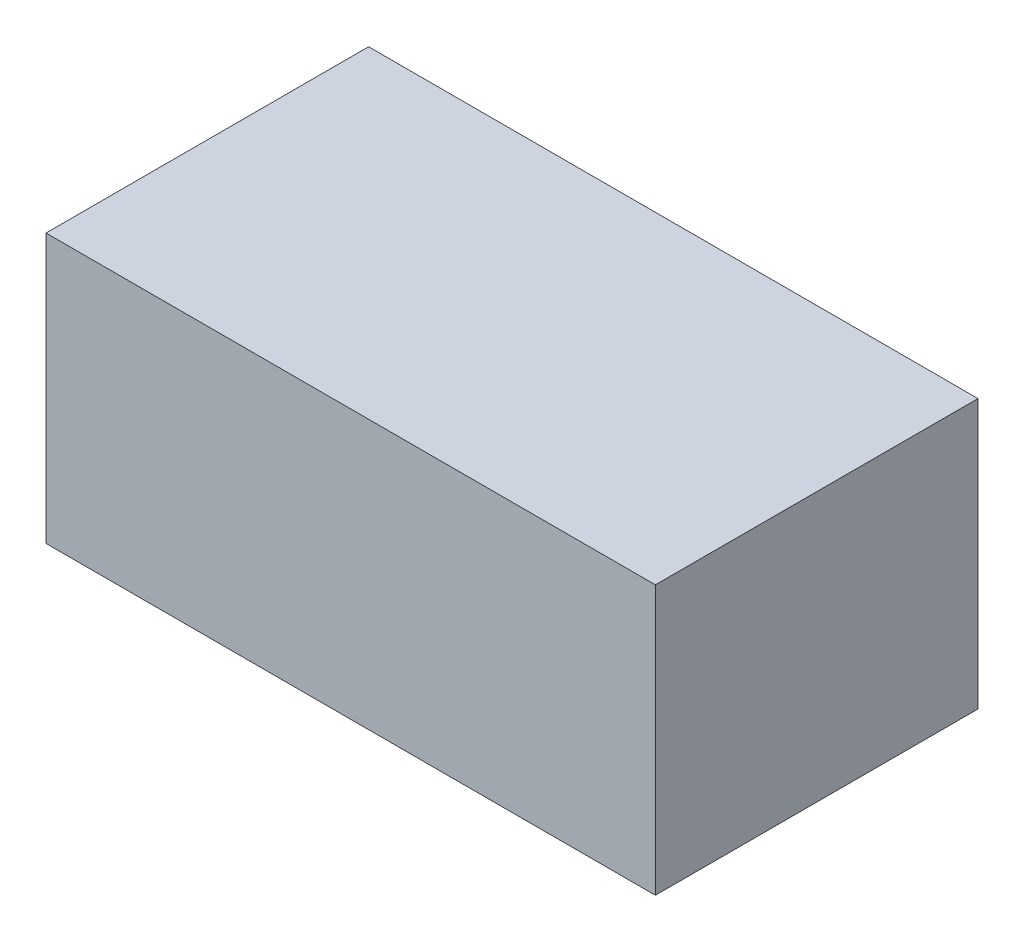
from build123d import *

# Parameters (mm, degrees)
SKETCH1_W           = 1.7
SKETCH1_H           = 0.75
BOSS_EXTRUDE1_DEPTH = 0.9


with BuildPart() as part:
    # Sketch1 → Boss-Extrude1 (new body)
    with BuildSketch(Plane.XY):
        with Locations((0.85, 0.375)):
            Rectangle(SKETCH1_W, SKETCH1_H)
    extrude(amount=BOSS_EXTRUDE1_DEPTH)


solid = part.part
